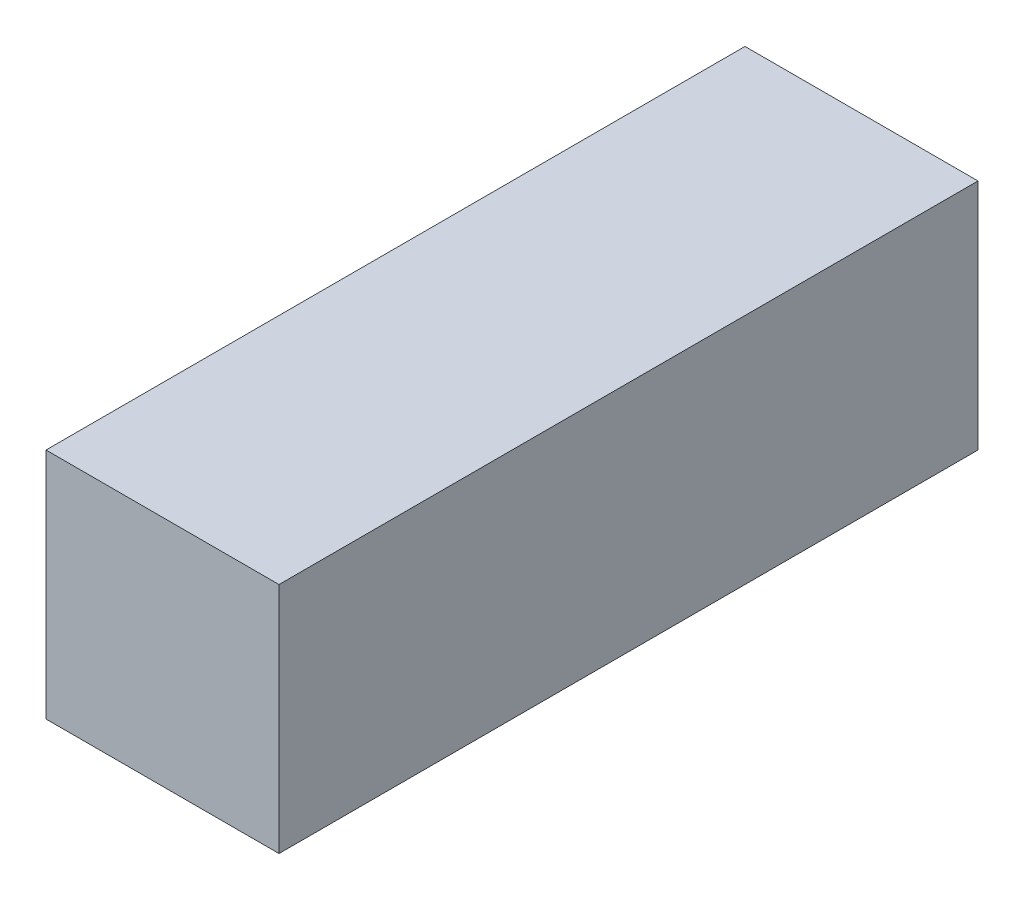
from build123d import *

# Parameters (mm, degrees)
SKETCH1_W           = 100
SKETCH1_H           = 100
BOSS_EXTRUDE1_DEPTH = 300


with BuildPart() as part:
    # Sketch1 → Boss-Extrude1 (new body)
    with BuildSketch(Plane.XY):
        with Locations((-7.761732852, -7.400722022)):
            Rectangle(SKETCH1_W, SKETCH1_H)
    extrude(amount=BOSS_EXTRUDE1_DEPTH)


solid = part.part
